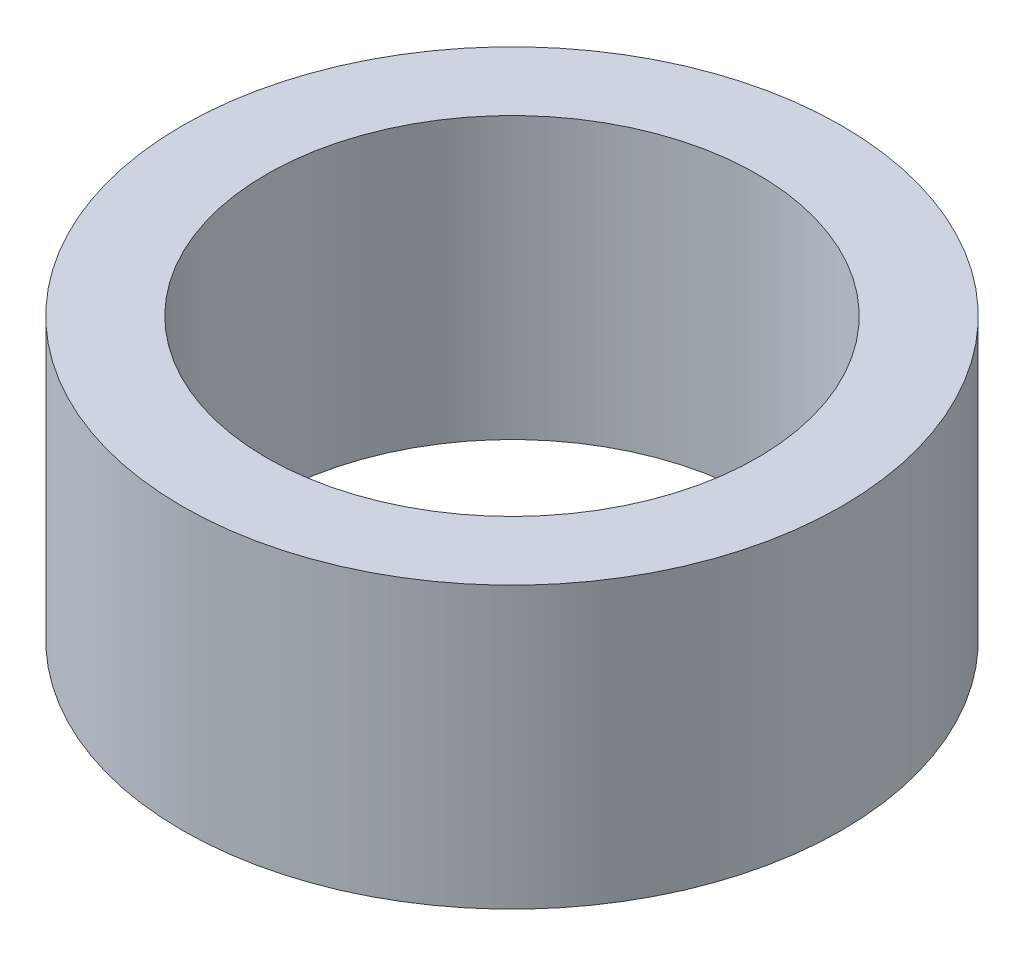
from build123d import *

# Parameters (mm, degrees)
SKETCH2_R           = 23.5
BOSS_EXTRUDE1_DEPTH = 20
SKETCH4_R           = 17.5
CUT_EXTRUDE1_DEPTH  = 39.787884706


with BuildPart() as part:
    # Sketch2 → Boss-Extrude1 (new body)
    with BuildSketch(Plane(origin=(0, 0, 0), x_dir=(1, 0, 0), z_dir=(0, 1, 0))):
        with Locations(Location((0, 0, 0), (0, 0, 270))):
            Circle(SKETCH2_R)
    extrude(amount=BOSS_EXTRUDE1_DEPTH)

    # Sketch4 → Cut-Extrude1 (cut, through all)
    with BuildSketch(Plane(origin=(0, 20, 0), x_dir=(1, 0, 0), z_dir=(0, 1, 0))):
        with Locations(Location((0, 0, 0), (0, 0, 270))):
            Circle(SKETCH4_R)
    extrude(amount=-CUT_EXTRUDE1_DEPTH, mode=Mode.SUBTRACT)


solid = part.part
